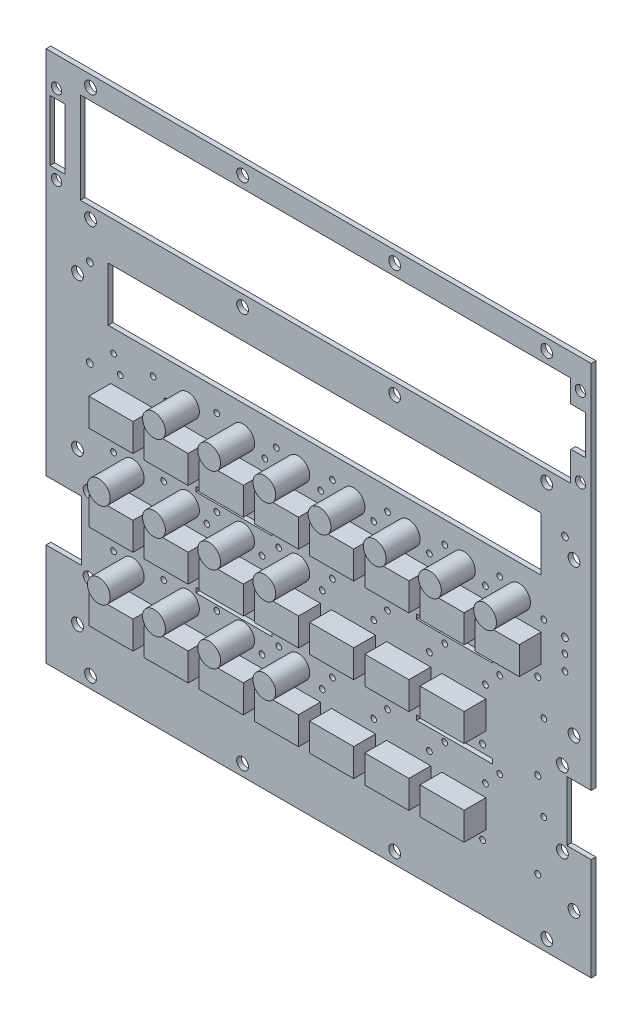
from build123d import *

# Parameters (mm, degrees)
SKETCH1_W                       = 144.56156
SKETCH1_H                       = 18.00098
SKETCH1_W_2                     = 5.08
SKETCH1_H_2                     = 20.32
SKETCH1_W_3                     = 25.4
SKETCH1_H_3                     = 1.5875
BOARD_DEPTH                     = 1.592072
SKETCH11_R                      = 3.81
LED_KINGBRIGHT_3P_2P54_10_DEPTH = 11.3538
SKETCH12_R                      = 3.81
LED_KINGBRIGHT_3P_2P54_11_DEPTH = 11.3538
SKETCH13_R                      = 3.81
LED_KINGBRIGHT_3P_2P54_12_DEPTH = 11.3538
SKETCH14_R                      = 3.81
LED_KINGBRIGHT_3P_2P54_13_DEPTH = 11.3538
SKETCH15_R                      = 3.81
LED_KINGBRIGHT_3P_2P54_14_DEPTH = 11.3538
SKETCH16_R                      = 3.81
LED_KINGBRIGHT_3P_2P54_15_DEPTH = 11.3538
SKETCH17_R                      = 3.81
LED_KINGBRIGHT_3P_2P54_16_DEPTH = 11.3538
SKETCH18_R                      = 3.81
LED_KINGBRIGHT_3P_2P54_17_DEPTH = 11.3538
SKETCH19_R                      = 3.81
LED_KINGBRIGHT_3P_2P54_18_DEPTH = 11.3538
SKETCH20_R                      = 3.81
LED_KINGBRIGHT_3P_2P54_19_DEPTH = 11.3538
SKETCH21_R                      = 3.81
LED_KINGBRIGHT_3P_2P54_20_DEPTH = 11.3538
SKETCH22_R                      = 3.81
LED_KINGBRIGHT_3P_2P54_21_DEPTH = 11.3538
SKETCH23_R                      = 3.81
LED_KINGBRIGHT_3P_2P54_22_DEPTH = 11.3538
SKETCH24_R                      = 3.81
LED_KINGBRIGHT_3P_2P54_23_DEPTH = 11.3538
SKETCH25_R                      = 3.81
LED_KINGBRIGHT_3P_2P54_24_DEPTH = 11.3538
SKETCH29_W                      = 14.732
SKETCH29_H                      = 9.271
SWITCH_MCDTS2_3_DEPTH           = 7.3000108
SKETCH30_W                      = 14.732
SKETCH30_H                      = 9.271
SWITCH_MCDTS2_4_DEPTH           = 7.3000108
SKETCH31_W                      = 14.732
SKETCH31_H                      = 9.271
SWITCH_MCDTS2_5_DEPTH           = 7.3000108
SKETCH32_W                      = 14.732
SKETCH32_H                      = 9.271
SWITCH_MCDTS2_6_DEPTH           = 7.3000108
SKETCH33_W                      = 14.732
SKETCH33_H                      = 9.271
SWITCH_MCDTS2_7_DEPTH           = 7.3000108
SKETCH34_W                      = 14.732
SKETCH34_H                      = 9.271
SWITCH_MCDTS2_8_DEPTH           = 7.3000108
SKETCH35_W                      = 14.732
SKETCH35_H                      = 9.271
SWITCH_MCDTS2_9_DEPTH           = 7.3000108
SKETCH36_W                      = 14.732
SKETCH36_H                      = 9.271
SWITCH_MCDTS2_10_DEPTH          = 7.3000108
SKETCH37_W                      = 14.732
SKETCH37_H                      = 9.271
SWITCH_MCDTS2_11_DEPTH          = 7.3000108
SKETCH38_W                      = 14.732
SKETCH38_H                      = 9.271
SWITCH_MCDTS2_12_DEPTH          = 7.3000108
SKETCH39_W                      = 14.732
SKETCH39_H                      = 9.271
SWITCH_MCDTS2_13_DEPTH          = 7.3000108
SKETCH40_W                      = 14.732
SKETCH40_H                      = 9.271
SWITCH_MCDTS2_14_DEPTH          = 7.3000108
SKETCH41_W                      = 14.732
SKETCH41_H                      = 9.271
SWITCH_MCDTS2_15_DEPTH          = 7.3000108
SKETCH42_W                      = 14.732
SKETCH42_H                      = 9.271
SWITCH_MCDTS2_16_DEPTH          = 7.3000108
SKETCH43_W                      = 14.732
SKETCH43_H                      = 9.271
SWITCH_MCDTS2_17_DEPTH          = 7.3000108
SKETCH44_W                      = 14.732
SKETCH44_H                      = 9.271
SWITCH_MCDTS2_18_DEPTH          = 7.3000108
SKETCH45_W                      = 14.732
SKETCH45_H                      = 9.271
SWITCH_MCDTS2_19_DEPTH          = 7.3000108
SKETCH46_W                      = 14.732
SKETCH46_H                      = 9.271
SWITCH_MCDTS2_20_DEPTH          = 7.3000108
SKETCH47_W                      = 14.732
SKETCH47_H                      = 9.271
SWITCH_MCDTS2_21_DEPTH          = 7.3000108
SKETCH48_W                      = 14.732
SKETCH48_H                      = 9.271
SWITCH_MCDTS2_22_DEPTH          = 7.3000108
SKETCH49_W                      = 14.732
SKETCH49_H                      = 9.271
SWITCH_MCDTS2_23_DEPTH          = 7.3000108
SKETCH50_W                      = 14.732
SKETCH50_H                      = 9.271
SWITCH_MCDTS2_24_DEPTH          = 7.3000108
SKETCH52_R                      = 1.016
SKETCH52_R_2                    = 0.9652
SKETCH52_R_3                    = 0.9525
SKETCH52_R_4                    = 1.9685
SKETCH52_R_5                    = 1.1303
SKETCH52_R_6                    = 1.7145
CUT_EXTRUDE1_DEPTH              = 2.54


with BuildPart() as part:
    # Sketch1 → BOARD (new body)
    with BuildSketch(Plane.XY):
        Polygon((0, 0), (182.118, 0), (182.118, 34.24682), (173.98746, 34.24682), (173.98746, 54.24678), (182.118, 54.24678), (182.118, 177.8), (0, 177.8), (0, 54.24678), (11.86942, 54.24678), (11.86942, 34.24682), (0, 34.24682), align=None)
        with Locations((93.01988, 117.17909)):
            Rectangle(SKETCH1_W, SKETCH1_H, mode=Mode.SUBTRACT)
        with Locations((3.81, 154.813)):
            Rectangle(SKETCH1_W_2, SKETCH1_H_2, mode=Mode.SUBTRACT)
        Polygon((12.7, 170.18), (175.26, 170.18), (175.26, 162.6616), (180.086, 162.6616), (180.2892, 162.4584), (180.2892, 149.606), (175.3616, 149.606), (175.26, 149.5044), (175.26, 139.7), (12.7, 139.7), (11.43, 139.7), (11.43, 170.18), align=None, mode=Mode.SUBTRACT)
        with Locations((62.7634, 46.20895)):
            Rectangle(SKETCH1_W_3, SKETCH1_H_3, mode=Mode.SUBTRACT)
        with Locations((136.5134176, 46.20895)):
            Rectangle(SKETCH1_W_3, SKETCH1_H_3, mode=Mode.SUBTRACT)
        with Locations((136.5134176, 75.41895)):
            Rectangle(SKETCH1_W_3, SKETCH1_H_3, mode=Mode.SUBTRACT)
        with Locations((62.7634, 75.41895)):
            Rectangle(SKETCH1_W_3, SKETCH1_H_3, mode=Mode.SUBTRACT)
    extrude(amount=BOARD_DEPTH)

    # Sketch52 → Cut-Extrude1 (cut)
    with BuildSketch(Plane.XY.offset(1.592072)):
        with Locations((164.2745, 21.1074)):
            Circle(SKETCH52_R)
        with Locations((164.2745, 49.6824)):
            Circle(SKETCH52_R)
        with Locations((145.8341, 21.8186)):
            Circle(SKETCH52_R_2)
        with Locations((127.4191, 21.6154)):
            Circle(SKETCH52_R_2)
        with Locations((108.9787, 21.7424)):
            Circle(SKETCH52_R_2)
        with Locations((90.5383, 21.844)):
            Circle(SKETCH52_R_2)
        with Locations((72.0979, 20.7772)):
            Circle(SKETCH52_R_2)
        with Locations((53.6575, 21.1582)):
            Circle(SKETCH52_R_2)
        with Locations((35.2187002, 21.1328)):
            Circle(SKETCH52_R)
        with Locations((145.8341, 49.5554)):
            Circle(SKETCH52_R)
        with Locations((127.3937, 49.3522)):
            Circle(SKETCH52_R)
        with Locations((108.9533, 49.1236)):
            Circle(SKETCH52_R)
        with Locations((90.5129, 49.6824)):
            Circle(SKETCH52_R)
        with Locations((72.0725, 49.1998)):
            Circle(SKETCH52_R)
        with Locations((53.6321, 49.1998)):
            Circle(SKETCH52_R)
        with Locations((35.1917, 49.276)):
            Circle(SKETCH52_R)
        with Locations((164.2745, 78.2574)):
            Circle(SKETCH52_R)
        with Locations((145.8341, 77.7748)):
            Circle(SKETCH52_R)
        with Locations((127.3175, 78.3336)):
            Circle(SKETCH52_R)
        with Locations((108.9533, 78.74)):
            Circle(SKETCH52_R)
        with Locations((90.5129, 78.3336)):
            Circle(SKETCH52_R)
        with Locations((72.0725, 78.2574)):
            Circle(SKETCH52_R)
        with Locations((53.6321, 78.4098)):
            Circle(SKETCH52_R)
        with Locations((35.1917, 78.0542)):
            Circle(SKETCH52_R)
        with Locations((92.2655, 38.6588)):
            Circle(SKETCH52_R_3)
        with Locations((77.7367, 43.7388)):
            Circle(SKETCH52_R_3)
        with Locations((72.1487, 38.6588)):
            Circle(SKETCH52_R_3)
        with Locations((57.0611, 43.7388)):
            Circle(SKETCH52_R_3)
        with Locations((39.3065, 43.7388)):
            Circle(SKETCH52_R_3)
        with Locations((22.4663, 38.6588)):
            Circle(SKETCH52_R_3)
        with Locations((22.5425, 43.7388)):
            Circle(SKETCH52_R_3)
        with Locations((77.7367, 72.3138)):
            Circle(SKETCH52_R_3)
        with Locations((92.2655, 67.2338)):
            Circle(SKETCH52_R_3)
        with Locations((72.1487, 67.2338)):
            Circle(SKETCH52_R_3)
        with Locations((57.0611, 72.3138)):
            Circle(SKETCH52_R_3)
        with Locations((53.7083, 67.2338)):
            Circle(SKETCH52_R_3)
        with Locations((39.3065, 72.3138)):
            Circle(SKETCH52_R_3)
        with Locations((22.4663, 67.2338)):
            Circle(SKETCH52_R_3)
        with Locations((22.5425, 72.3138)):
            Circle(SKETCH52_R_3)
        with Locations((166.3065, 95.8088)):
            Circle(SKETCH52_R_3)
        with Locations((151.5491, 100.8888)):
            Circle(SKETCH52_R_3)
        with Locations((146.7993, 95.8088)):
            Circle(SKETCH52_R_3)
        with Locations((133.1849, 100.8888)):
            Circle(SKETCH52_R_3)
        with Locations((114.0587, 100.8888)):
            Circle(SKETCH52_R_3)
        with Locations((128.0795, 95.8088)):
            Circle(SKETCH52_R_3)
        with Locations((109.4359, 95.8088)):
            Circle(SKETCH52_R_3)
        with Locations((95.6691, 100.8888)):
            Circle(SKETCH52_R_3)
        with Locations((91.7575, 95.8088)):
            Circle(SKETCH52_R_3)
        with Locations((76.9493, 100.8888)):
            Circle(SKETCH52_R_3)
        with Locations((73.1139, 95.8088)):
            Circle(SKETCH52_R_3)
        with Locations((56.9849, 100.8888)):
            Circle(SKETCH52_R_3)
        with Locations((40.2971, 95.8088)):
            Circle(SKETCH52_R_3)
        with Locations((35.7505, 100.8888)):
            Circle(SKETCH52_R_3)
        with Locations((24.7777, 95.8088)):
            Circle(SKETCH52_R_3)
        with Locations((22.5425, 100.8888)):
            Circle(SKETCH52_R_3)
        with Locations((133.1849, 72.3138)):
            Circle(SKETCH52_R_3)
        with Locations((146.7993, 67.2338)):
            Circle(SKETCH52_R_3)
        with Locations((114.0587, 72.3138)):
            Circle(SKETCH52_R_3)
        with Locations((128.0795, 67.2338)):
            Circle(SKETCH52_R_3)
        with Locations((95.6691, 72.3138)):
            Circle(SKETCH52_R_3)
        with Locations((109.4359, 67.2338)):
            Circle(SKETCH52_R_3)
        with Locations((151.5491, 43.7388)):
            Circle(SKETCH52_R_3)
        with Locations((133.1849, 43.7388)):
            Circle(SKETCH52_R_3)
        with Locations((114.0587, 43.7388)):
            Circle(SKETCH52_R_3)
        with Locations((95.6691, 43.7388)):
            Circle(SKETCH52_R_3)
        with Locations((109.4359, 38.6588)):
            Circle(SKETCH52_R_3)
        with Locations((151.5491, 72.3138)):
            Circle(SKETCH52_R_3)
        with Locations((166.3065, 67.2338)):
            Circle(SKETCH52_R_3)
        with Locations((173.3296, 89.4588)):
            Circle(SKETCH52_R_3)
        with Locations((173.355, 84.3534)):
            Circle(SKETCH52_R_3)
        with Locations((176.37252, 118.11)):
            Circle(SKETCH52_R_4)
        with Locations((176.37252, 67.31)):
            Circle(SKETCH52_R_4)
        with Locations((176.37252, 16.51)):
            Circle(SKETCH52_R_4)
        with Locations((167.259, 135.89)):
            Circle(SKETCH52_R_4)
        with Locations((116.459, 135.89)):
            Circle(SKETCH52_R_4)
        with Locations((65.659, 135.89)):
            Circle(SKETCH52_R_4)
        with Locations((14.859, 135.89)):
            Circle(SKETCH52_R_4)
        with Locations((10.51052, 118.11)):
            Circle(SKETCH52_R_4)
        with Locations((10.51052, 67.31)):
            Circle(SKETCH52_R_4)
        with Locations((10.51052, 16.51)):
            Circle(SKETCH52_R_4)
        with Locations((166.3065, 38.6588)):
            Circle(SKETCH52_R_3)
        with Locations((146.7993, 38.6588)):
            Circle(SKETCH52_R_3)
        with Locations((128.0795, 38.6588)):
            Circle(SKETCH52_R_3)
        with Locations((14.859, 173.99)):
            Circle(SKETCH52_R_4)
        with Locations((65.659, 173.99)):
            Circle(SKETCH52_R_4)
        with Locations((116.459, 173.99)):
            Circle(SKETCH52_R_4)
        with Locations((167.259, 173.99)):
            Circle(SKETCH52_R_4)
        with Locations((167.259, 3.81)):
            Circle(SKETCH52_R_4)
        with Locations((116.459, 3.81)):
            Circle(SKETCH52_R_4)
        with Locations((65.659, 3.81)):
            Circle(SKETCH52_R_4)
        with Locations((14.859, 3.81)):
            Circle(SKETCH52_R_4)
        with Locations((172.50664, 56.7436)):
            Circle(SKETCH52_R_4)
        with Locations((172.50664, 31.75)):
            Circle(SKETCH52_R_4)
        with Locations((14.36878, 56.7436)):
            Circle(SKETCH52_R_4)
        with Locations((14.36878, 31.75)):
            Circle(SKETCH52_R_4)
        with Locations((173.35754, 123.37542)):
            Circle(SKETCH52_R_5)
        with Locations((173.35754, 94.16542)):
            Circle(SKETCH52_R_5)
        with Locations((14.60754, 94.16542)):
            Circle(SKETCH52_R_5)
        with Locations((14.60754, 123.37542)):
            Circle(SKETCH52_R_5)
        with Locations((178.51374, 141.56182)):
            Circle(SKETCH52_R_6)
        with Locations((178.51374, 168.06164)):
            Circle(SKETCH52_R_6)
        with Locations((3.50012, 168.06164)):
            Circle(SKETCH52_R_6)
        with Locations((3.50012, 141.56182)):
            Circle(SKETCH52_R_6)
    extrude(amount=-CUT_EXTRUDE1_DEPTH, mode=Mode.SUBTRACT)


with BuildPart() as body_2:
    # Sketch11 → LED-KINGBRIGHT_3P_2P54-10 (new body)
    with BuildSketch(Plane.XY.offset(1.592072)):
        with Locations((84.2812132, 41.1988)):
            Circle(SKETCH11_R)
    extrude(amount=LED_KINGBRIGHT_3P_2P54_10_DEPTH)


with BuildPart() as body_3:
    # Sketch12 → LED-KINGBRIGHT_3P_2P54-11 (new body)
    with BuildSketch(Plane.XY.offset(1.592072)):
        with Locations((65.8437088, 41.1988)):
            Circle(SKETCH12_R)
    extrude(amount=LED_KINGBRIGHT_3P_2P54_11_DEPTH)


with BuildPart() as body_4:
    # Sketch13 → LED-KINGBRIGHT_3P_2P54-12 (new body)
    with BuildSketch(Plane.XY.offset(1.592072)):
        with Locations((47.4062044, 41.1988)):
            Circle(SKETCH13_R)
    extrude(amount=LED_KINGBRIGHT_3P_2P54_12_DEPTH)


with BuildPart() as body_5:
    # Sketch14 → LED-KINGBRIGHT_3P_2P54-13 (new body)
    with BuildSketch(Plane.XY.offset(1.592072)):
        with Locations((28.9687, 41.1988)):
            Circle(SKETCH14_R)
    extrude(amount=LED_KINGBRIGHT_3P_2P54_13_DEPTH)


with BuildPart() as body_6:
    # Sketch15 → LED-KINGBRIGHT_3P_2P54-14 (new body)
    with BuildSketch(Plane.XY.offset(1.592072)):
        with Locations((84.2812132, 69.7738)):
            Circle(SKETCH15_R)
    extrude(amount=LED_KINGBRIGHT_3P_2P54_14_DEPTH)


with BuildPart() as body_7:
    # Sketch16 → LED-KINGBRIGHT_3P_2P54-15 (new body)
    with BuildSketch(Plane.XY.offset(1.592072)):
        with Locations((65.8437088, 69.7738)):
            Circle(SKETCH16_R)
    extrude(amount=LED_KINGBRIGHT_3P_2P54_15_DEPTH)


with BuildPart() as body_8:
    # Sketch17 → LED-KINGBRIGHT_3P_2P54-16 (new body)
    with BuildSketch(Plane.XY.offset(1.592072)):
        with Locations((47.4062044, 69.7738)):
            Circle(SKETCH17_R)
    extrude(amount=LED_KINGBRIGHT_3P_2P54_16_DEPTH)


with BuildPart() as body_9:
    # Sketch18 → LED-KINGBRIGHT_3P_2P54-17 (new body)
    with BuildSketch(Plane.XY.offset(1.592072)):
        with Locations((28.9687, 69.7738)):
            Circle(SKETCH18_R)
    extrude(amount=LED_KINGBRIGHT_3P_2P54_17_DEPTH)


with BuildPart() as body_10:
    # Sketch19 → LED-KINGBRIGHT_3P_2P54-18 (new body)
    with BuildSketch(Plane.XY.offset(1.592072)):
        with Locations((158.0312308, 98.3488)):
            Circle(SKETCH19_R)
    extrude(amount=LED_KINGBRIGHT_3P_2P54_18_DEPTH)


with BuildPart() as body_11:
    # Sketch20 → LED-KINGBRIGHT_3P_2P54-19 (new body)
    with BuildSketch(Plane.XY.offset(1.592072)):
        with Locations((139.5937264, 98.3488)):
            Circle(SKETCH20_R)
    extrude(amount=LED_KINGBRIGHT_3P_2P54_19_DEPTH)


with BuildPart() as body_12:
    # Sketch21 → LED-KINGBRIGHT_3P_2P54-20 (new body)
    with BuildSketch(Plane.XY.offset(1.592072)):
        with Locations((121.156222, 98.3488)):
            Circle(SKETCH21_R)
    extrude(amount=LED_KINGBRIGHT_3P_2P54_20_DEPTH)


with BuildPart() as body_13:
    # Sketch22 → LED-KINGBRIGHT_3P_2P54-21 (new body)
    with BuildSketch(Plane.XY.offset(1.592072)):
        with Locations((102.7187176, 98.3488)):
            Circle(SKETCH22_R)
    extrude(amount=LED_KINGBRIGHT_3P_2P54_21_DEPTH)


with BuildPart() as body_14:
    # Sketch23 → LED-KINGBRIGHT_3P_2P54-22 (new body)
    with BuildSketch(Plane.XY.offset(1.592072)):
        with Locations((84.2812132, 98.3488)):
            Circle(SKETCH23_R)
    extrude(amount=LED_KINGBRIGHT_3P_2P54_22_DEPTH)


with BuildPart() as body_15:
    # Sketch24 → LED-KINGBRIGHT_3P_2P54-23 (new body)
    with BuildSketch(Plane.XY.offset(1.592072)):
        with Locations((65.8437088, 98.3488)):
            Circle(SKETCH24_R)
    extrude(amount=LED_KINGBRIGHT_3P_2P54_23_DEPTH)


with BuildPart() as body_16:
    # Sketch25 → LED-KINGBRIGHT_3P_2P54-24 (new body)
    with BuildSketch(Plane.XY.offset(1.592072)):
        with Locations((47.4062044, 98.3488)):
            Circle(SKETCH25_R)
    extrude(amount=LED_KINGBRIGHT_3P_2P54_24_DEPTH)


with BuildPart() as body_17:
    # Sketch29 → SWITCH-MCDTS2-3 (new body)
    with BuildSketch(Plane.XY.offset(1.592072)):
        with Locations((139.5937264, 29.9593)):
            Rectangle(SKETCH29_W, SKETCH29_H)
    extrude(amount=SWITCH_MCDTS2_3_DEPTH)


with BuildPart() as body_18:
    # Sketch30 → SWITCH-MCDTS2-4 (new body)
    with BuildSketch(Plane.XY.offset(1.592072)):
        with Locations((121.156222, 29.9593)):
            Rectangle(SKETCH30_W, SKETCH30_H)
    extrude(amount=SWITCH_MCDTS2_4_DEPTH)


with BuildPart() as body_19:
    # Sketch31 → SWITCH-MCDTS2-5 (new body)
    with BuildSketch(Plane.XY.offset(1.592072)):
        with Locations((102.7187176, 29.9593)):
            Rectangle(SKETCH31_W, SKETCH31_H)
    extrude(amount=SWITCH_MCDTS2_5_DEPTH)


with BuildPart() as body_20:
    # Sketch32 → SWITCH-MCDTS2-6 (new body)
    with BuildSketch(Plane.XY.offset(1.592072)):
        with Locations((84.2812132, 29.9593)):
            Rectangle(SKETCH32_W, SKETCH32_H)
    extrude(amount=SWITCH_MCDTS2_6_DEPTH)


with BuildPart() as body_21:
    # Sketch33 → SWITCH-MCDTS2-7 (new body)
    with BuildSketch(Plane.XY.offset(1.592072)):
        with Locations((65.8437088, 29.9593)):
            Rectangle(SKETCH33_W, SKETCH33_H)
    extrude(amount=SWITCH_MCDTS2_7_DEPTH)


with BuildPart() as body_22:
    # Sketch34 → SWITCH-MCDTS2-8 (new body)
    with BuildSketch(Plane.XY.offset(1.592072)):
        with Locations((47.4062044, 29.9593)):
            Rectangle(SKETCH34_W, SKETCH34_H)
    extrude(amount=SWITCH_MCDTS2_8_DEPTH)


with BuildPart() as body_23:
    # Sketch35 → SWITCH-MCDTS2-9 (new body)
    with BuildSketch(Plane.XY.offset(1.592072)):
        with Locations((28.9687, 29.9593)):
            Rectangle(SKETCH35_W, SKETCH35_H)
    extrude(amount=SWITCH_MCDTS2_9_DEPTH)


with BuildPart() as body_24:
    # Sketch36 → SWITCH-MCDTS2-10 (new body)
    with BuildSketch(Plane.XY.offset(1.592072)):
        with Locations((139.5937264, 58.5343)):
            Rectangle(SKETCH36_W, SKETCH36_H)
    extrude(amount=SWITCH_MCDTS2_10_DEPTH)


with BuildPart() as body_25:
    # Sketch37 → SWITCH-MCDTS2-11 (new body)
    with BuildSketch(Plane.XY.offset(1.592072)):
        with Locations((121.156222, 58.5343)):
            Rectangle(SKETCH37_W, SKETCH37_H)
    extrude(amount=SWITCH_MCDTS2_11_DEPTH)


with BuildPart() as body_26:
    # Sketch38 → SWITCH-MCDTS2-12 (new body)
    with BuildSketch(Plane.XY.offset(1.592072)):
        with Locations((102.7187176, 58.5343)):
            Rectangle(SKETCH38_W, SKETCH38_H)
    extrude(amount=SWITCH_MCDTS2_12_DEPTH)


with BuildPart() as body_27:
    # Sketch39 → SWITCH-MCDTS2-13 (new body)
    with BuildSketch(Plane.XY.offset(1.592072)):
        with Locations((84.2812132, 58.5343)):
            Rectangle(SKETCH39_W, SKETCH39_H)
    extrude(amount=SWITCH_MCDTS2_13_DEPTH)


with BuildPart() as body_28:
    # Sketch40 → SWITCH-MCDTS2-14 (new body)
    with BuildSketch(Plane.XY.offset(1.592072)):
        with Locations((65.8437088, 58.5343)):
            Rectangle(SKETCH40_W, SKETCH40_H)
    extrude(amount=SWITCH_MCDTS2_14_DEPTH)


with BuildPart() as body_29:
    # Sketch41 → SWITCH-MCDTS2-15 (new body)
    with BuildSketch(Plane.XY.offset(1.592072)):
        with Locations((47.4062044, 58.5343)):
            Rectangle(SKETCH41_W, SKETCH41_H)
    extrude(amount=SWITCH_MCDTS2_15_DEPTH)


with BuildPart() as body_30:
    # Sketch42 → SWITCH-MCDTS2-16 (new body)
    with BuildSketch(Plane.XY.offset(1.592072)):
        with Locations((28.9687, 58.5343)):
            Rectangle(SKETCH42_W, SKETCH42_H)
    extrude(amount=SWITCH_MCDTS2_16_DEPTH)


with BuildPart() as body_31:
    # Sketch43 → SWITCH-MCDTS2-17 (new body)
    with BuildSketch(Plane.XY.offset(1.592072)):
        with Locations((158.0312308, 87.1093)):
            Rectangle(SKETCH43_W, SKETCH43_H)
    extrude(amount=SWITCH_MCDTS2_17_DEPTH)


with BuildPart() as body_32:
    # Sketch44 → SWITCH-MCDTS2-18 (new body)
    with BuildSketch(Plane.XY.offset(1.592072)):
        with Locations((139.5937264, 87.1093)):
            Rectangle(SKETCH44_W, SKETCH44_H)
    extrude(amount=SWITCH_MCDTS2_18_DEPTH)


with BuildPart() as body_33:
    # Sketch45 → SWITCH-MCDTS2-19 (new body)
    with BuildSketch(Plane.XY.offset(1.592072)):
        with Locations((121.156222, 87.1093)):
            Rectangle(SKETCH45_W, SKETCH45_H)
    extrude(amount=SWITCH_MCDTS2_19_DEPTH)


with BuildPart() as body_34:
    # Sketch46 → SWITCH-MCDTS2-20 (new body)
    with BuildSketch(Plane.XY.offset(1.592072)):
        with Locations((102.7187176, 87.1093)):
            Rectangle(SKETCH46_W, SKETCH46_H)
    extrude(amount=SWITCH_MCDTS2_20_DEPTH)


with BuildPart() as body_35:
    # Sketch47 → SWITCH-MCDTS2-21 (new body)
    with BuildSketch(Plane.XY.offset(1.592072)):
        with Locations((84.2812132, 87.1093)):
            Rectangle(SKETCH47_W, SKETCH47_H)
    extrude(amount=SWITCH_MCDTS2_21_DEPTH)


with BuildPart() as body_36:
    # Sketch48 → SWITCH-MCDTS2-22 (new body)
    with BuildSketch(Plane.XY.offset(1.592072)):
        with Locations((65.8437088, 87.1093)):
            Rectangle(SKETCH48_W, SKETCH48_H)
    extrude(amount=SWITCH_MCDTS2_22_DEPTH)


with BuildPart() as body_37:
    # Sketch49 → SWITCH-MCDTS2-23 (new body)
    with BuildSketch(Plane.XY.offset(1.592072)):
        with Locations((47.4062044, 87.1093)):
            Rectangle(SKETCH49_W, SKETCH49_H)
    extrude(amount=SWITCH_MCDTS2_23_DEPTH)


with BuildPart() as body_38:
    # Sketch50 → SWITCH-MCDTS2-24 (new body)
    with BuildSketch(Plane.XY.offset(1.592072)):
        with Locations((28.9687, 87.1093)):
            Rectangle(SKETCH50_W, SKETCH50_H)
    extrude(amount=SWITCH_MCDTS2_24_DEPTH)


solid = Compound([part.part, body_2.part, body_3.part, body_4.part, body_5.part, body_6.part, body_7.part, body_8.part, body_9.part, body_10.part, body_11.part, body_12.part, body_13.part, body_14.part, body_15.part, body_16.part, body_17.part, body_18.part, body_19.part, body_20.part, body_21.part, body_22.part, body_23.part, body_24.part, body_25.part, body_26.part, body_27.part, body_28.part, body_29.part, body_30.part, body_31.part, body_32.part, body_33.part, body_34.part, body_35.part, body_36.part, body_37.part, body_38.part])
